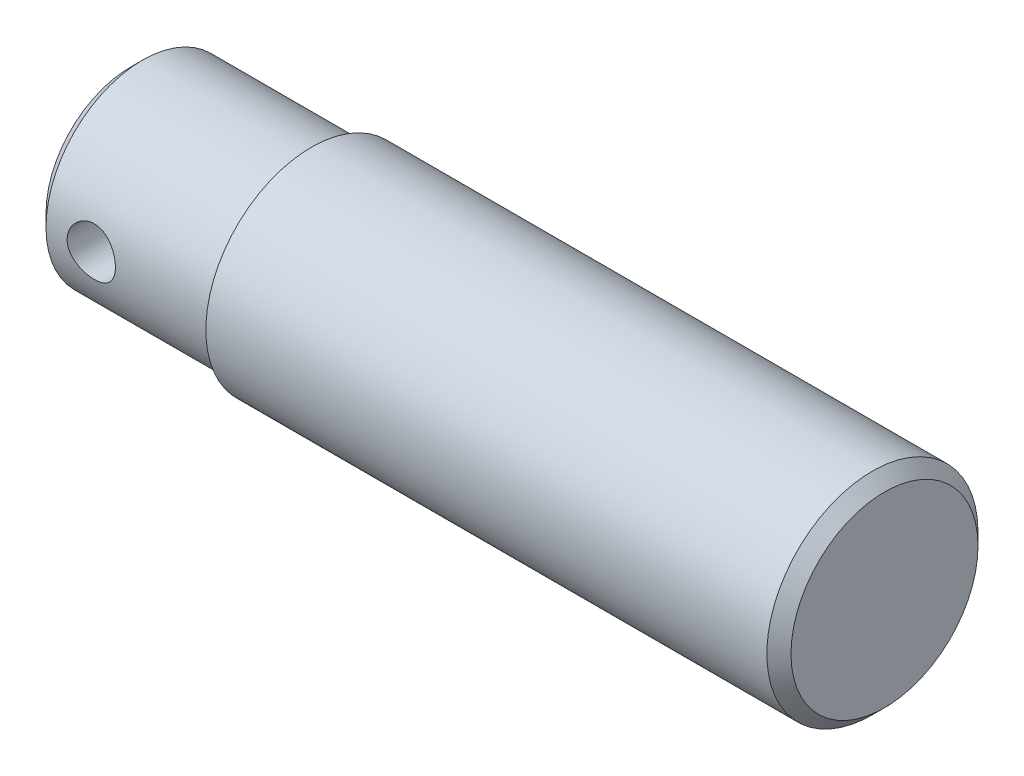
from build123d import *

# Parameters (mm, degrees)
SCHIZZO1_R             = 17.5
ESTRUSIONE1_DEPTH      = 95
SCHIZZO2_R             = 16
ESTRUSIONE2_DEPTH      = 30
SMUSSO2_SIZE           = 2
SMUSSO3_SIZE           = 2
ESTRUSIONE6_DEPTH      = 99.17076958
ESTRUSIONE6_DEPTH_BACK = 99.17076958
SCHIZZO5_R             = 4


with BuildPart() as part:
    # Schizzo1 → Estrusione1 (new body)
    with BuildSketch(Plane(origin=(0, 0, 0), x_dir=(0, 0, -1), z_dir=(1, 0, 0))):
        Circle(SCHIZZO1_R)
    extrude(amount=ESTRUSIONE1_DEPTH)

    # Schizzo2 → Estrusione2 (add)
    with BuildSketch(Plane.ZY):
        with Locations(Location((0, 0, 0), (0, 0, 180))):
            Circle(SCHIZZO2_R)
    extrude(amount=ESTRUSIONE2_DEPTH)

    # Smusso2
    smusso2_edges = [part.edges().sort_by_distance(p)[0] for p in [
        (95, 0, 17.5),
    ]]
    chamfer(smusso2_edges, length=SMUSSO2_SIZE)

    # Smusso3
    smusso3_edges = [part.edges().sort_by_distance(p)[0] for p in [
        (-30, 0, 16),
    ]]
    chamfer(smusso3_edges, length=SMUSSO3_SIZE)

    # Schizzo5 → Estrusione6 (cut, two sides: drawn at the far end of the back side and taken through both)
    with BuildSketch(Plane.XY.offset(-ESTRUSIONE6_DEPTH_BACK)):
        with Locations((-20.5, 0)):
            Circle(SCHIZZO5_R)
    extrude(amount=ESTRUSIONE6_DEPTH + ESTRUSIONE6_DEPTH_BACK, mode=Mode.SUBTRACT)


solid = part.part
